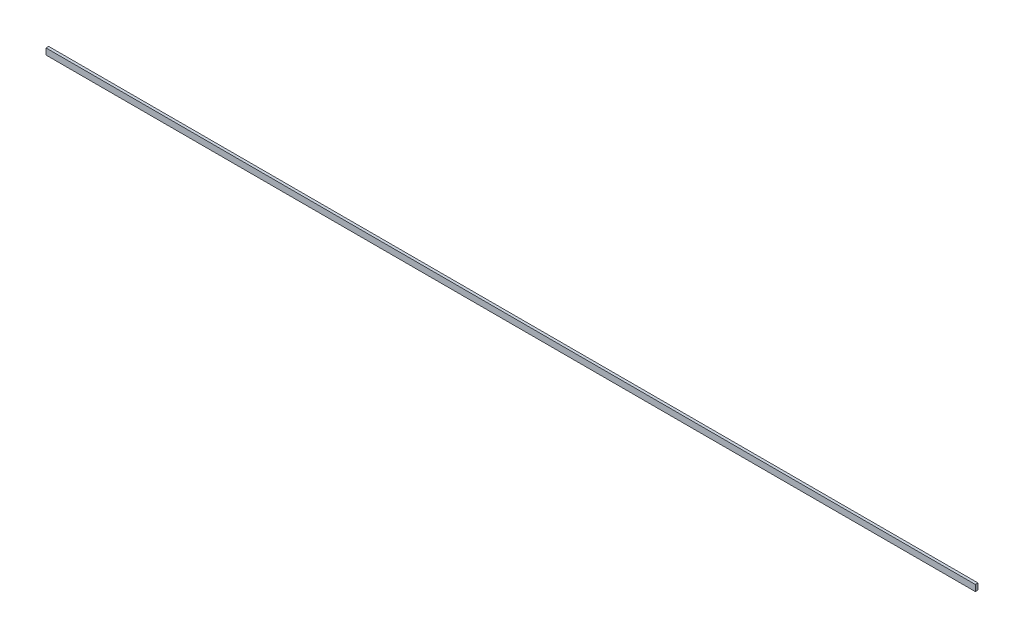
from build123d import *

# Parameters (mm, degrees)
SKETCH_1_W      = 525.1
SKETCH_1_H      = 3.5
EXTRUDE_1_DEPTH = 1.5


with BuildPart() as part:
    # 草图1 → 凸台-拉伸1 (new body)
    with BuildSketch(Plane.XY):
        with Locations((262.55, -1.75)):
            Rectangle(SKETCH_1_W, SKETCH_1_H)
    extrude(amount=EXTRUDE_1_DEPTH)


solid = part.part
